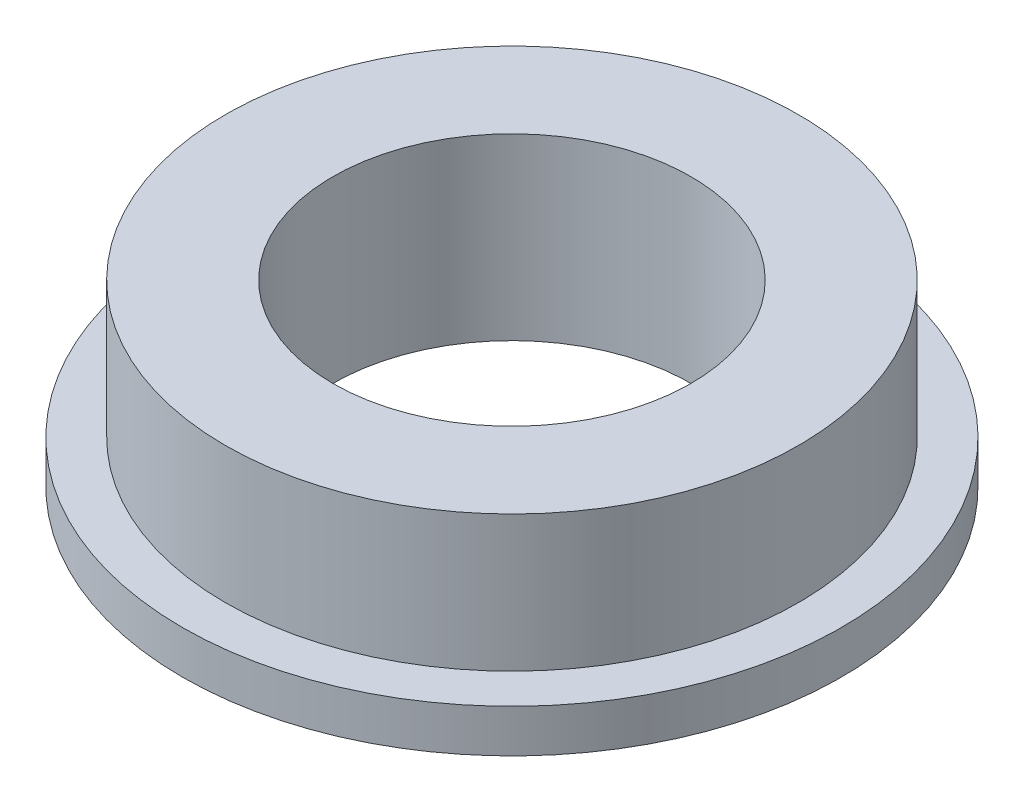
from build123d import *

# Parameters (mm, degrees)
SKETCH_1_R      = 4
SKETCH_1_R_2    = 2.5
EXTRUDE_1_DEPTH = 2.5
SKETCH_2_R      = 4.6
SKETCH_2_R_2    = 4
EXTRUDE_2_DEPTH = 0.6


with BuildPart() as part:
    # 草图1 → 凸台-拉伸1 (new body)
    with BuildSketch(Plane(origin=(0, 0, 0), x_dir=(1, 0, 0), z_dir=(0, 1, 0))):
        with Locations(Location((0, 0, 0), (0, 0, 270))):
            Circle(SKETCH_1_R)
        with Locations(Location((0, 0, 0), (0, 0, 270))):
            Circle(SKETCH_1_R_2, mode=Mode.SUBTRACT)
    extrude(amount=EXTRUDE_1_DEPTH)

    # 草图2 → 凸台-拉伸2 (add)
    with BuildSketch(Plane(origin=(0, 0, 0), x_dir=(1, 0, 0), z_dir=(0, 1, 0))):
        with Locations(Location((0, 0, 0), (0, 0, 270))):
            Circle(SKETCH_2_R)
        with Locations(Location((0, 0, 0), (0, 0, 270))):
            Circle(SKETCH_2_R_2, mode=Mode.SUBTRACT)
    extrude(amount=EXTRUDE_2_DEPTH)


solid = part.part
